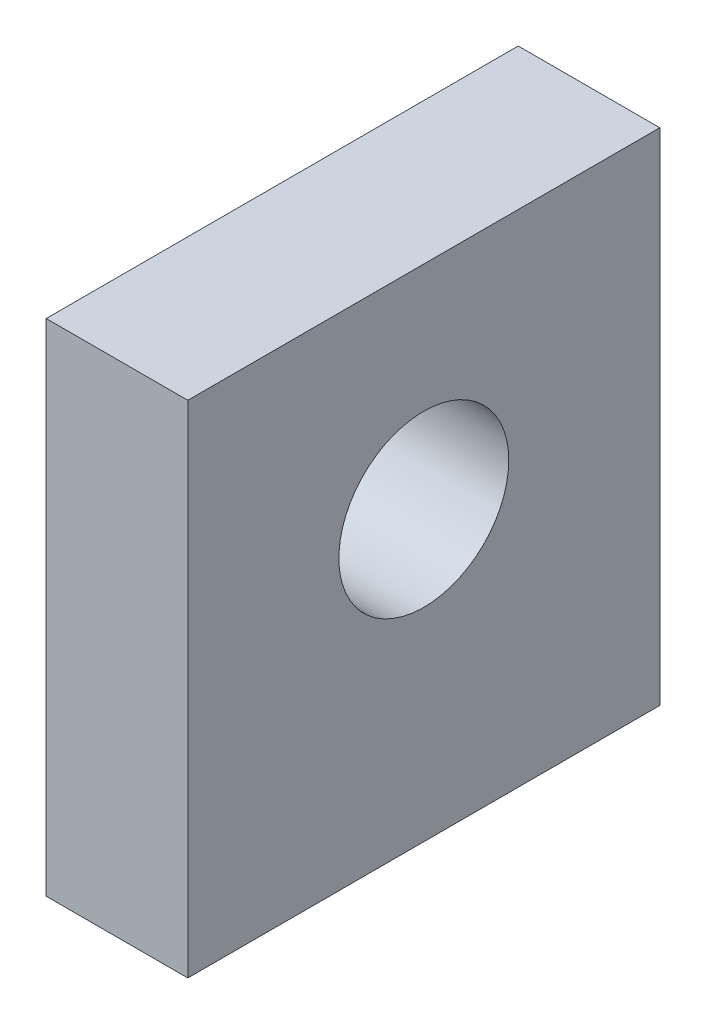
from build123d import *

# Parameters (mm, degrees)
CROQUIS1_W              = 50
CROQUIS1_H              = 53
CROQUIS1_R              = 9
SALIENTE_EXTRUIR1_DEPTH = 15


with BuildPart() as part:
    # Croquis1 → Saliente-Extruir1 (new body)
    with BuildSketch(Plane(origin=(0, 0, 0), x_dir=(0, 0, -1), z_dir=(1, 0, 0))):
        Rectangle(CROQUIS1_W, CROQUIS1_H)
        with Locations((0, 4)):
            Circle(CROQUIS1_R, mode=Mode.SUBTRACT)
    extrude(amount=SALIENTE_EXTRUIR1_DEPTH)


solid = part.part
